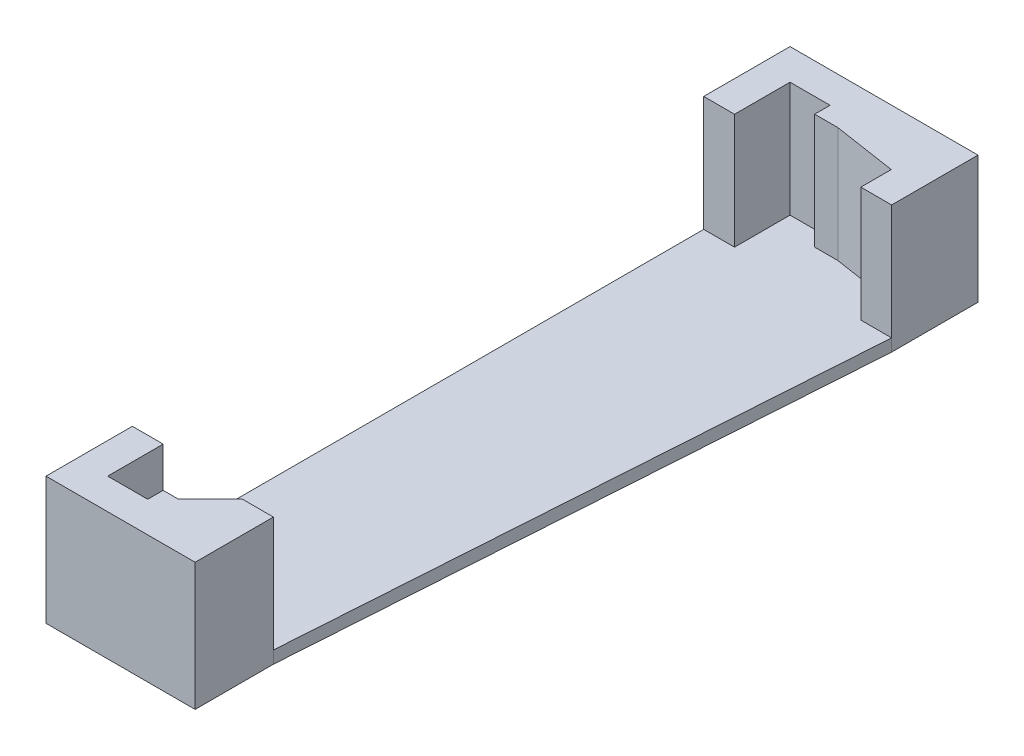
from build123d import *

# Parameters (mm, degrees)
SKETCH1_W           = 38.699948
SKETCH1_H           = 153.19375
BOSS_EXTRUDE1_DEPTH = 2.54
BOSS_EXTRUDE2_DEPTH = 23.706666582
CUT_EXTRUDE1_DEPTH  = 160.77490754


with BuildPart() as part:
    # Sketch1 → Boss-Extrude1 (new body)
    with BuildSketch(Plane(origin=(0, 0, 0), x_dir=(1, 0, 0), z_dir=(0, 1, 0))):
        with Locations((19.349974, 76.596875)):
            Rectangle(SKETCH1_W, SKETCH1_H)
    extrude(amount=BOSS_EXTRUDE1_DEPTH)

    # Sketch3 → Boss-Extrude2 (add)
    with BuildSketch(Plane(origin=(0, 2.54, 0), x_dir=(1, 0, 0), z_dir=(0, 1, 0))):
        Polygon((6.35, 146.84375), (14.5875, 146.84375), (14.5875, 143.66875), (19.35, 143.66875), (32.35, 141.684375), (32.35, 135.41375), (38.7, 135.41375), (38.7, 153.19375), (0, 153.19375), (0, 135.41375), (6.35, 135.41375), align=None)
        Polygon((17.7625, 9.525), (14.5875, 9.525), (14.5875, 6.35), (6.35, 6.35), (6.35, 17.78), (0, 17.78), (0, 0), (30.703239638, 0), (30.703239638, 16.115739638), (24.353239638, 16.115739638), align=None)
    extrude(amount=BOSS_EXTRUDE2_DEPTH)

    # Sketch4 → Cut-Extrude1 (cut, through all)
    with BuildSketch(Plane(origin=(0, 2.54, 0), x_dir=(1, 0, 0), z_dir=(0, 1, 0))):
        Polygon((30.703239638, 0), (38.699948, 0), (38.699948, 135.41375), (30.703239638, 16.115739638), align=None)
    extrude(amount=-CUT_EXTRUDE1_DEPTH, mode=Mode.SUBTRACT)


solid = part.part
